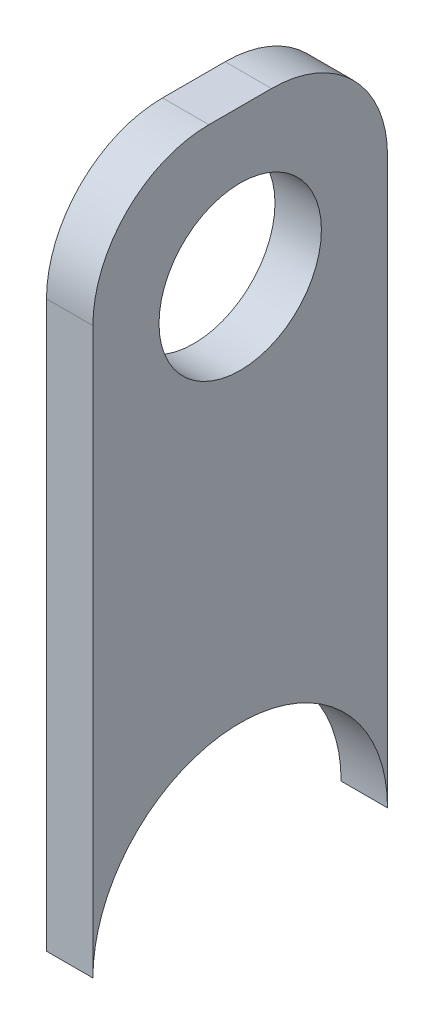
from build123d import *

# Parameters (mm, degrees)
SKETCH1_R           = 7
BOSS_EXTRUDE1_DEPTH = 4


with BuildPart() as part:
    # Sketch1 → Boss-Extrude1 (new body)
    with BuildSketch(Plane(origin=(0, 0, 0), x_dir=(0, 0, -1), z_dir=(1, 0, 0))):
        with BuildLine():
            Line((-12.7, 0), (-12.7, 48.71))
            ThreePointArc((-12.7, 48.71), (-9.771067812, 55.781067812), (-2.7, 58.71))
            Line((-2.7, 58.71), (2.7, 58.71))
            ThreePointArc((2.7, 58.71), (9.771067812, 55.781067812), (12.7, 48.71))
            Line((12.7, 48.71), (12.7, 0))
            ThreePointArc((12.7, 0), (0, 12.7), (-12.7, 0))
        make_face()
        with Locations((0, 46.01)):
            Circle(SKETCH1_R, mode=Mode.SUBTRACT)
    extrude(amount=BOSS_EXTRUDE1_DEPTH)


solid = part.part
